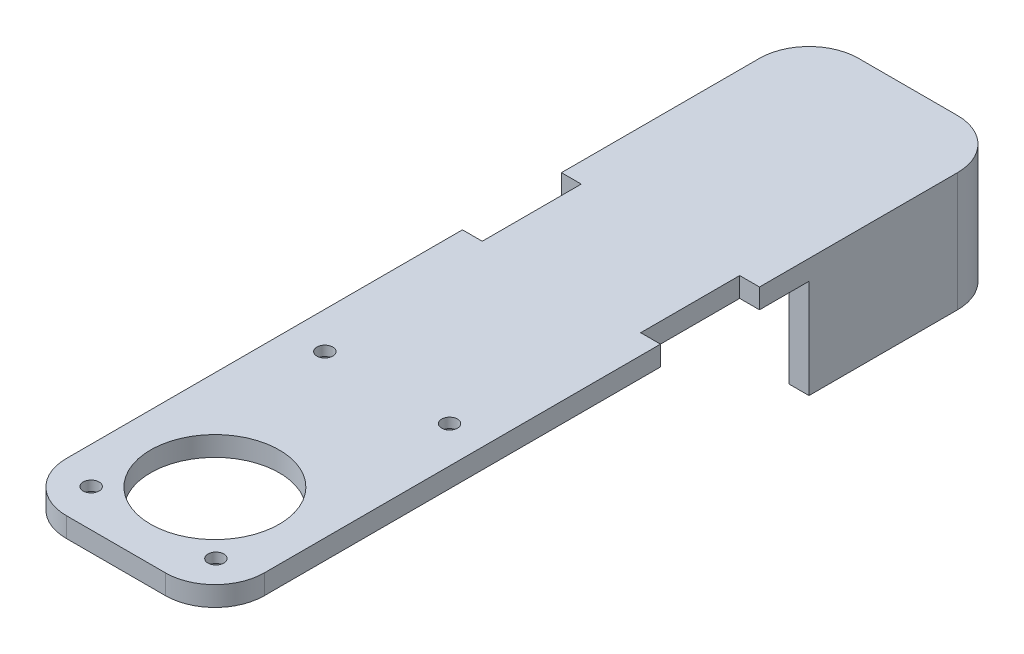
from build123d import *

# Parameters (mm, degrees)
SKETCH1_W           = 25.4
SKETCH1_H           = 101.6
SKETCH1_R           = 8.255
BOSS_EXTRUDE1_DEPTH = 2.54
SKETCH3_W           = 2.54
SKETCH3_H           = 25.4
BOSS_EXTRUDE2_DEPTH = 12.7
SKETCH2_R           = 1.016
CUT_EXTRUDE3_DEPTH  = 12.7
FILLET1_R           = 6.35
SKETCH5_R           = 2.032
CUT_EXTRUDE4_DEPTH  = 1.27
SKETCH6_W           = 2.54
SKETCH6_H           = 12.7
CUT_EXTRUDE5_DEPTH  = 91.696141042


with BuildPart() as part:
    # Sketch1 → Boss-Extrude1 (new body)
    with BuildSketch(Plane(origin=(0, 0, 0), x_dir=(1, 0, 0), z_dir=(0, 1, 0))):
        with Locations((0, 38.1)):
            Rectangle(SKETCH1_W, SKETCH1_H)
        with Locations(Location((0, 0, 0), (0, 0, 270))):
            Circle(SKETCH1_R, mode=Mode.SUBTRACT)
    extrude(amount=BOSS_EXTRUDE1_DEPTH)

    # Sketch3 → Boss-Extrude2 (add)
    with BuildSketch(Plane.XZ):
        with Locations((-11.43, -76.2)):
            Rectangle(SKETCH3_W, SKETCH3_H)
        with Locations((11.43, -76.2)):
            Rectangle(SKETCH3_W, SKETCH3_H)
    extrude(amount=BOSS_EXTRUDE2_DEPTH)

    # Sketch2 → Cut-Extrude3 (cut)
    with BuildSketch(Plane(origin=(0, 2.54, 0), x_dir=(1, 0, 0), z_dir=(0, 1, 0))):
        with Locations(Location((-8.000000002, 22.098, 0), (0, 0, 270))):
            Circle(SKETCH2_R)
        with Locations(Location((8.000000002, 22.098, 0), (0, 0, 90))):
            Circle(SKETCH2_R)
        with Locations(Location((-8.000000002, -7.874, 0), (0, 0, 270))):
            Circle(SKETCH2_R)
        with Locations(Location((8.000000002, -7.874, 0), (0, 0, 90))):
            Circle(SKETCH2_R)
    extrude(amount=-CUT_EXTRUDE3_DEPTH, mode=Mode.SUBTRACT)

    # Fillet1
    fillet1_edges = [part.edges().sort_by_distance(p)[0] for p in [
        (12.7, 1.27, 12.7),
        (-12.7, 1.27, 12.7),
        (12.7, -5.08, -88.9),
        (-12.7, -5.08, -88.9),
    ]]
    fillet(fillet1_edges, radius=FILLET1_R)

    # Sketch5 → Cut-Extrude4 (cut)
    with BuildSketch(Plane.XZ):
        with Locations(Location((-8.000000002, -22.098, 0), (0, 0, 270))):
            Circle(SKETCH5_R)
        with Locations(Location((-8.000000002, 7.874, 0), (0, 0, 270))):
            Circle(SKETCH5_R)
        with Locations(Location((8.000000002, -22.098, 0), (0, 0, 270))):
            Circle(SKETCH5_R)
        with Locations(Location((8.000000002, 7.874, 0), (0, 0, 270))):
            Circle(SKETCH5_R)
    extrude(amount=-CUT_EXTRUDE4_DEPTH, mode=Mode.SUBTRACT)

    # Sketch6 → Cut-Extrude5 (cut, through all)
    with BuildSketch(Plane.XZ):
        with Locations((11.43, -50.8)):
            Rectangle(SKETCH6_W, SKETCH6_H)
        with Locations((-11.43, -50.8)):
            Rectangle(SKETCH6_W, SKETCH6_H)
    extrude(amount=-CUT_EXTRUDE5_DEPTH, mode=Mode.SUBTRACT)


solid = part.part
